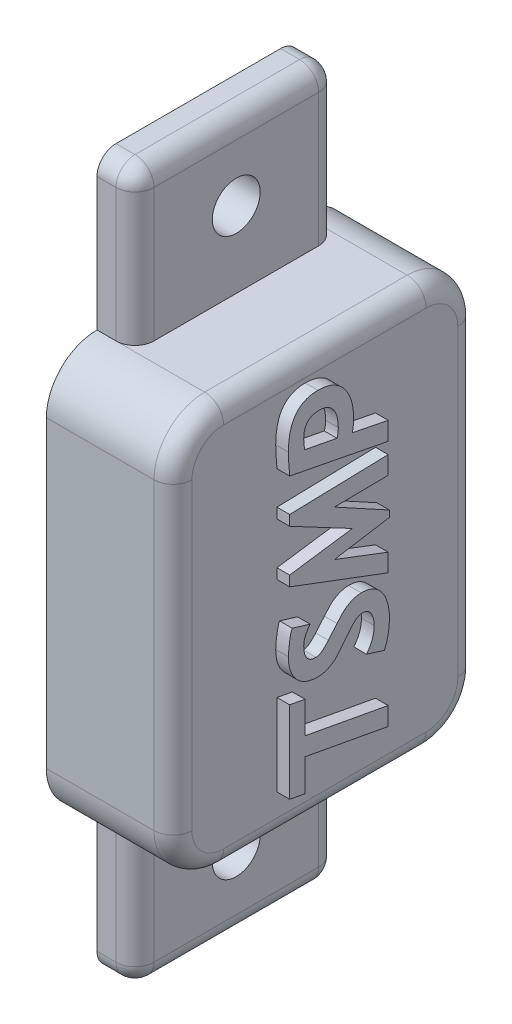
from build123d import *

# Parameters (mm, degrees)
BOSS_EXTRUDE1_DEPTH  = 6.35
SHELL1_T             = -1.27
SKETCH2_W            = 3.81
SKETCH2_H            = 20.32
BOSS_EXTRUDE2_DEPTH  = 15.24
M4_CLEARANCE_HOLE1_D = 4.8
BOSS_EXTRUDE3_DEPTH  = 1.27
FILLET1_R            = 1.905


with BuildPart() as part:
    # Sketch1 → Boss-Extrude1 (new, symmetric)
    with BuildSketch(Plane(origin=(0, 0, 0), x_dir=(0, 0, -1), z_dir=(1, 0, 0))):
        with BuildLine():
            Line((10.16, 20.32), (-10.16, 20.32))
            ThreePointArc((-10.16, 20.32), (-13.752102448, 18.832102448), (-15.24, 15.24))
            Line((-15.24, 15.24), (-15.24, -15.24))
            ThreePointArc((-15.24, -15.24), (-13.752102448, -18.832102448), (-10.16, -20.32))
            Line((-10.16, -20.32), (10.16, -20.32))
            ThreePointArc((10.16, -20.32), (13.752102448, -18.832102448), (15.24, -15.24))
            Line((15.24, -15.24), (15.24, 15.24))
            ThreePointArc((15.24, 15.24), (13.752102448, 18.832102448), (10.16, 20.32))
        make_face()
    extrude(amount=BOSS_EXTRUDE1_DEPTH, both=True)

    # Shell1
    shell1_openings = [part.faces().sort_by_distance(p)[0] for p in [
        (-6.35, 0, 0),
    ]]
    offset(amount=SHELL1_T, openings=shell1_openings, kind=Kind.INTERSECTION)

    # Sketch2 → Boss-Extrude2 (add)
    with BuildSketch(Plane.XZ.offset(20.32)):
        with Locations((-4.445, 0)):
            Rectangle(SKETCH2_W, SKETCH2_H)
    boss_extrude2 = extrude(amount=BOSS_EXTRUDE2_DEPTH)

    # M4 Clearance Hole1 (through all)
    with Locations(Plane(origin=(-2.54, 0, 0), x_dir=(0, 0, -1), z_dir=(1, 0, 0))):
        with Locations((0, -27.94)):
            m4_clearance_hole1 = Hole(M4_CLEARANCE_HOLE1_D / 2)

    # Mirror1: Boss-Extrude2, M4 Clearance Hole1 across plane
    add(boss_extrude2.mirror(Plane.ZX))
    add(m4_clearance_hole1.mirror(Plane.ZX), mode=Mode.SUBTRACT)

    # Sketch8 → Boss-Extrude3 (add)
    # profile 1 of 4: a face of its own
    with BuildSketch(Plane(origin=(6.35, 0, 0), x_dir=(0, 0, -1), z_dir=(1, 0, 0))):
        Polygon((-3.263618594, -8.225283619), (-3.263618594, -11.400271175), (5.08, -12.938625853), (5.08, -14.761786743), (-3.263618594, -13.221426387), (-3.263618594, -16.430510462), (-4.80397895, -16.14570425), (-4.80397895, -7.934460374), align=None)
    # profile 2 of 4: a face of its own
    with BuildSketch(Plane(origin=(6.35, 0, 0), x_dir=(0, 0, -1), z_dir=(1, 0, 0))):
        with BuildLine():
            add(Edge.make_bspline(
                [(-2.750165142, -1.95352993), (-2.80125104, -2.017677687), (-2.900986105, -2.142913435), (-3.031358515, -2.338261172), (-3.143006892, -2.533506612), (-3.233848259, -2.730752845), (-3.303890362, -2.928950045), (-3.354883675, -3.127492488), (-3.386187219, -3.327085952), (-3.39005041, -3.461020967), (-3.391981957, -3.527986804)],
                knots=[0, 0, 0, 0, 1.133835457, 2.213588423, 3.244729749, 4.241933598, 5.212939244, 6.148192762, 7.07411947, 8, 8, 8, 8], degree=3))
            add(Edge.make_bspline(
                [(-3.391981957, -3.527986804), (-3.3916293, -3.592878461), (-3.390944594, -3.718869665), (-3.373803164, -3.900934818), (-3.349810891, -4.070269357), (-3.319309536, -4.227879526), (-3.274070717, -4.37216332), (-3.222660858, -4.505639649), (-3.160855456, -4.626504675), (-3.087780872, -4.734006273), (-3.005813293, -4.828538209), (-2.913292027, -4.910514792), (-2.811858608, -4.980505864), (-2.699620978, -5.036969834), (-2.579328244, -5.08160209), (-2.448326395, -5.110523489), (-2.308949539, -5.131974126), (-2.212064918, -5.133667989), (-2.162501621, -5.134534519)],
                knots=[0, 0, 0, 0, 1.348400188, 2.618003204, 3.79729431, 4.903916575, 5.950249029, 6.936131378, 7.874740588, 8.765194314, 9.632015617, 10.468790778, 11.328451844, 12.186200925, 13.074374078, 13.987954761, 14.97069735, 16, 16, 16, 16], degree=3))
            add(Edge.make_bspline(
                [(-2.162501621, -5.134534519), (-2.117436706, -5.131528884), (-2.024312956, -5.125317932), (-1.88280649, -5.081657896), (-1.736607088, -5.012195006), (-1.58315581, -4.916720556), (-1.425322977, -4.792915034), (-1.260334105, -4.64296288), (-1.088306144, -4.467290665), (-0.976998716, -4.336338494), (-0.918981542, -4.268081819)],
                knots=[0, 0, 0, 0, 0.694159026, 1.434435008, 2.264250846, 3.185048469, 4.213538291, 5.351707008, 6.619620628, 8, 8, 8, 8], degree=3))
            Line((-0.918981542, -4.268081819), (-0.054534519, -3.24518627))
            add(Edge.make_bspline(
                [(-0.054534519, -3.24518627), (0.007627221, -3.172308071), (0.122069723, -3.038136097), (0.279085299, -2.854357732), (0.413087131, -2.710696977), (0.521828813, -2.591380531), (0.63069573, -2.492559642), (0.748004134, -2.396766845), (0.884686606, -2.300051516), (1.086844297, -2.168430987), (1.353379879, -2.021290492), (1.687687303, -1.892462062), (2.026955675, -1.812767653), (2.256261402, -1.80229614), (2.370329635, -1.797087082)],
                knots=[0, 0, 0, 0, 1.177344829, 2.16754369, 2.970114562, 3.592054745, 4.150321937, 4.775294408, 5.452530373, 6.206922649, 7.740144076, 9.18372903, 10.599044785, 12, 12, 12, 12], degree=3))
            add(Edge.make_bspline(
                [(2.370329635, -1.797087082), (2.478836795, -1.799964201), (2.69094982, -1.805588481), (2.998846952, -1.855418306), (3.28972316, -1.932701452), (3.560883137, -2.045837123), (3.814753113, -2.189996227), (4.050631053, -2.364961838), (4.266669818, -2.574066327), (4.461480384, -2.813118763), (4.638288906, -3.075229865), (4.789881922, -3.359679973), (4.921682336, -3.660747475), (5.025154706, -3.982411783), (5.10687616, -4.321730324), (5.16790922, -4.680057446), (5.201067337, -5.057685433), (5.205896626, -5.315653535), (5.208363363, -5.447420217)],
                knots=[0, 0, 0, 0, 1.000944879, 1.956676835, 2.8713823, 3.773321029, 4.66046572, 5.560227304, 6.476762848, 7.428101528, 8.401990658, 9.390473608, 10.399320134, 11.431674743, 12.504852098, 13.618809142, 14.783719319, 16, 16, 16, 16], degree=3))
            add(Edge.make_bspline(
                [(5.208363363, -5.447420217), (5.206855206, -5.557777808), (5.203862691, -5.776751431), (5.178842454, -6.102740636), (5.139239727, -6.423452807), (5.082416071, -6.739992962), (5.010856006, -7.052140548), (4.921802425, -7.359874574), (4.818672032, -7.663007591), (4.736163682, -7.860022177), (4.694909911, -7.958528505)],
                knots=[0, 0, 0, 0, 1.02600741, 2.035823327, 3.038187761, 4.02956232, 5.024807818, 6.014465778, 7.00724262, 8, 8, 8, 8], degree=3))
            Line((4.694909911, -7.958528505), (2.897822829, -7.388916082))
            add(Edge.make_bspline(
                [(2.897822829, -7.388916082), (2.959364284, -7.312381552), (3.080897423, -7.161239828), (3.237818498, -6.91868989), (3.370486213, -6.66757251), (3.479726078, -6.407287772), (3.564256024, -6.137321737), (3.623924089, -5.858006554), (3.661279945, -5.570110201), (3.665746681, -5.37532925), (3.668003007, -5.276937625)],
                knots=[0, 0, 0, 0, 1.025794438, 2.02575676, 3.013365359, 3.990439165, 4.971576287, 5.965098467, 6.972090103, 8, 8, 8, 8], degree=3))
            add(Edge.make_bspline(
                [(3.668003007, -5.276937625), (3.663994722, -5.161083602), (3.656274846, -4.937951143), (3.601877118, -4.617508863), (3.501824564, -4.329519036), (3.389585851, -4.113482056), (3.282231782, -3.960506275), (3.191956208, -3.862792545), (3.095092781, -3.778818092), (2.988821213, -3.711558275), (2.874408538, -3.660154277), (2.752264675, -3.620636889), (2.621787845, -3.59925378), (2.532190601, -3.59588574), (2.486658932, -3.594174164)],
                knots=[0, 0, 0, 0, 1.812571679, 3.490975677, 5.062215305, 6.564139531, 7.283970624, 7.979844383, 8.640140766, 9.284334025, 9.939640691, 10.597945725, 11.287501843, 12, 12, 12, 12], degree=3))
            add(Edge.make_bspline(
                [(2.486658932, -3.594174164), (2.438951786, -3.597212088), (2.340631421, -3.603472991), (2.1925958, -3.645712179), (2.043176312, -3.716144538), (1.889639511, -3.811584745), (1.733068719, -3.935429567), (1.57348056, -4.087000052), (1.408564625, -4.263212942), (1.303746122, -4.394340407), (1.249155886, -4.462632541)],
                knots=[0, 0, 0, 0, 0.734068962, 1.51285361, 2.350769121, 3.270192263, 4.289022369, 5.417311782, 6.654917253, 8, 8, 8, 8], degree=3))
            Line((1.249155886, -4.462632541), (0.404765639, -5.527647318))
            add(Edge.make_bspline(
                [(0.404765639, -5.527647318), (0.344161042, -5.602718848), (0.233172899, -5.740200986), (0.078190288, -5.925533002), (-0.0489091, -6.072532992), (-0.157785231, -6.186597947), (-0.260952852, -6.281911519), (-0.375599357, -6.370811159), (-0.507280539, -6.461763927), (-0.702176664, -6.586646654), (-0.963589433, -6.722379395), (-1.291549182, -6.844902551), (-1.631844494, -6.917501274), (-1.861979507, -6.926889471), (-1.977979286, -6.931621601)],
                knots=[0, 0, 0, 0, 1.206671615, 2.209836345, 3.021614333, 3.63664281, 4.181119786, 4.776625886, 5.44931724, 6.182341803, 7.67082524, 9.123194503, 10.549943351, 12, 12, 12, 12], degree=3))
            add(Edge.make_bspline(
                [(-1.977979286, -6.931621601), (-2.088436006, -6.929053441), (-2.304834699, -6.92402209), (-2.62050583, -6.880880309), (-2.918727289, -6.81204172), (-3.198077668, -6.711302875), (-3.462534406, -6.589054057), (-3.70587649, -6.432018726), (-3.933410594, -6.250176307), (-4.14030324, -6.039987171), (-4.326720414, -5.807190911), (-4.489787292, -5.55609666), (-4.626674869, -5.28691941), (-4.739783954, -5.001105155), (-4.825105438, -4.697029016), (-4.887008478, -4.37639866), (-4.926313289, -4.039074292), (-4.930305531, -3.808223382), (-4.932342313, -3.690446686)],
                knots=[0, 0, 0, 0, 1.071649996, 2.099497959, 3.086361209, 4.036619296, 4.977078349, 5.907748306, 6.840090789, 7.799082401, 8.76385244, 9.730388481, 10.699686961, 11.690191589, 12.708987071, 13.76016689, 14.857270507, 16, 16, 16, 16], degree=3))
            add(Edge.make_bspline(
                [(-4.932342313, -3.690446686), (-4.930462207, -3.60483434), (-4.926447217, -3.422008045), (-4.902699038, -3.131017922), (-4.866182337, -2.806698164), (-4.818831787, -2.463228834), (-4.759311523, -2.132128916), (-4.696669399, -1.841035416), (-4.629643785, -1.605349605), (-4.572432677, -1.471089287), (-4.547252224, -1.411996993)],
                knots=[0, 0, 0, 0, 0.885005776, 1.889941524, 3.016369979, 4.258554003, 5.473153608, 6.492574728, 7.336533537, 8, 8, 8, 8], degree=3))
            Line((-4.547252224, -1.411996993), (-2.750165142, -1.95352993))
        make_face()
    # profile 3 of 4: a face of its own
    with BuildSketch(Plane(origin=(6.35, 0, 0), x_dir=(0, 0, -1), z_dir=(1, 0, 0))):
        Polygon((5.08, 7.059984964), (-0.311261245, 6.995803283), (5.208363363, 3.979264252), (5.208363363, 3.337447438), (-0.311261245, 2.438903897), (5.08, 0.385090089), (5.08, -1.411996993), (-4.80397895, 2.310540534), (-4.80397895, 3.337447438), (1.485825836, 4.235990978), (-4.80397895, 7.573438416), (-4.80397895, 8.60034532), (5.08, 8.857072046), align=None)
    # profile 4 of 4: a face of its own
    with BuildSketch(Plane(origin=(6.35, 0, 0), x_dir=(0, 0, -1), z_dir=(1, 0, 0))):
        with BuildLine():
            Line((1.485825836, 12.549524409), (5.08, 11.839514558))
            Line((5.08, 11.839514558), (5.08, 10.012342313))
            Line((5.08, 10.012342313), (-4.80397895, 11.937792757))
            add(Edge.make_bspline(
                [(-4.80397895, 11.937792757), (-4.814156449, 12.051434856), (-4.833847704, 12.271307686), (-4.860016651, 12.59088044), (-4.882078557, 12.889067657), (-4.900309123, 13.166519858), (-4.914485749, 13.423257287), (-4.924511389, 13.659275476), (-4.931022551, 13.874572005), (-4.931917059, 14.010990788), (-4.932342313, 14.075845022)],
                knots=[0, 0, 0, 0, 1.278075582, 2.47279924, 3.591696274, 4.62737318, 5.587396976, 6.471891417, 7.273528833, 8, 8, 8, 8], degree=3))
            add(Edge.make_bspline(
                [(-4.932342313, 14.075845022), (-4.929994019, 14.233018019), (-4.925441487, 14.537722257), (-4.89155068, 14.979844931), (-4.834371192, 15.392089824), (-4.752611172, 15.773582457), (-4.648650738, 16.124611989), (-4.522356955, 16.446063441), (-4.372807301, 16.7381611), (-4.197662971, 16.998753815), (-3.998688334, 17.228092416), (-3.777747093, 17.428874214), (-3.529803779, 17.595220741), (-3.262179375, 17.735411413), (-2.969855722, 17.841393104), (-2.655210366, 17.917798277), (-2.316805288, 17.96114947), (-2.083733047, 17.967570542), (-1.963939544, 17.970870818)],
                knots=[0, 0, 0, 0, 1.349950348, 2.617088167, 3.806041765, 4.922249814, 5.965128403, 6.947263793, 7.884733045, 8.778256218, 9.637211465, 10.487057785, 11.33441701, 12.194849098, 13.076015182, 13.998055437, 14.971048836, 16, 16, 16, 16], degree=3))
            add(Edge.make_bspline(
                [(-1.963939544, 17.970870818), (-1.828012188, 17.967787718), (-1.562952501, 17.961775643), (-1.177130868, 17.903782877), (-0.813470233, 17.811477848), (-0.470827565, 17.684602911), (-0.15298743, 17.514847555), (0.144163358, 17.311681133), (0.418059524, 17.069558943), (0.665037351, 16.791227647), (0.890743886, 16.488034969), (1.081961827, 16.156716338), (1.248142725, 15.806492065), (1.38221737, 15.433549866), (1.486747174, 15.038929234), (1.559108714, 14.622807642), (1.607848845, 14.185307146), (1.612041718, 13.886113427), (1.614189199, 13.732874162)],
                knots=[0, 0, 0, 0, 1.043771036, 2.035363831, 2.989681643, 3.92274997, 4.834970567, 5.751116451, 6.682769793, 7.63575955, 8.605600203, 9.581732248, 10.569793031, 11.580480364, 12.622100466, 13.702246182, 14.823150069, 16, 16, 16, 16], degree=3))
            add(Edge.make_bspline(
                [(1.614189199, 13.732874162), (1.612668604, 13.633207172), (1.609633206, 13.434252989), (1.584417121, 13.137025147), (1.545360043, 12.841560925), (1.505684214, 12.646936835), (1.485825836, 12.549524409)],
                knots=[0, 0, 0, 0, 1.002792616, 2.001763936, 2.999851341, 4, 4, 4, 4], degree=3))
        make_face()
        with BuildLine():
            Line((-3.285681047, 13.468124725), (-0.054534519, 12.844359008))
            add(Edge.make_bspline(
                [(-0.054534519, 12.844359008), (-0.034389061, 12.904147934), (0.008182138, 13.030493348), (0.045042439, 13.236945911), (0.070066075, 13.466159412), (0.072531969, 13.626489962), (0.073828844, 13.710811709)],
                knots=[0, 0, 0, 0, 0.859054739, 1.815346687, 2.851037535, 4, 4, 4, 4], degree=3))
            add(Edge.make_bspline(
                [(0.073828844, 13.710811709), (0.072049248, 13.802425308), (0.068562733, 13.981911076), (0.048426275, 14.243680523), (0.005595908, 14.490136473), (-0.043212252, 14.723412765), (-0.115963113, 14.941015423), (-0.19773167, 15.145815837), (-0.300310289, 15.334389308), (-0.415350356, 15.508461826), (-0.545197842, 15.665180046), (-0.689167391, 15.801471519), (-0.84690039, 15.916631203), (-1.017866417, 16.011429658), (-1.202840813, 16.08402228), (-1.40074977, 16.135698609), (-1.61249225, 16.169005793), (-1.758562062, 16.172162654), (-1.833570503, 16.173783736)],
                knots=[0, 0, 0, 0, 1.24919241, 2.447368744, 3.574156844, 4.657648451, 5.69239348, 6.697780648, 7.660149803, 8.613150923, 9.538556275, 10.428310763, 11.30882092, 12.194082615, 13.086028448, 14.010131266, 14.978180703, 16, 16, 16, 16], degree=3))
            add(Edge.make_bspline(
                [(-1.833570503, 16.173783736), (-1.896464905, 16.17283222), (-2.018587962, 16.170984647), (-2.195892267, 16.150898559), (-2.360690984, 16.116296397), (-2.515046517, 16.071710293), (-2.654406343, 16.008300871), (-2.784401337, 15.936080569), (-2.899772308, 15.846944023), (-3.006023366, 15.74695384), (-3.09542669, 15.630213154), (-3.178054972, 15.50368517), (-3.242153196, 15.360749146), (-3.297140382, 15.205827013), (-3.341340613, 15.038285162), (-3.370454454, 14.856219611), (-3.388863548, 14.661216875), (-3.39091994, 14.526498561), (-3.391981957, 14.456923756)],
                knots=[0, 0, 0, 0, 1.135201323, 2.204238386, 3.215063188, 4.173506686, 5.097587238, 5.973423975, 6.852167028, 7.722915285, 8.599500281, 9.500267513, 10.445316252, 11.418842399, 12.466959104, 13.568285608, 14.744149559, 16, 16, 16, 16], degree=3))
            add(Edge.make_bspline(
                [(-3.391981957, 14.456923756), (-3.390904793, 14.37933002), (-3.388700582, 14.220549198), (-3.367406535, 13.977538618), (-3.333416827, 13.72529466), (-3.301791366, 13.554916848), (-3.285681047, 13.468124725)],
                knots=[0, 0, 0, 0, 0.934643629, 1.91257042, 2.936642971, 4, 4, 4, 4], degree=3))
        make_face(mode=Mode.SUBTRACT)
    extrude(amount=BOSS_EXTRUDE3_DEPTH)

    # Fillet1
    fillet1_edges = [part.edges().sort_by_distance(p)[0] for p in [
        (6.35, 18.832102448, -13.752102448),
        (6.35, 20.32, 0),
        (6.35, 18.832102448, 13.752102448),
        (6.35, 0, 15.24),
        (6.35, -18.832102448, 13.752102448),
        (6.35, -20.32, 0),
        (-2.54, -27.94, -10.16),
        (-2.54, -27.94, 10.16),
        (-4.445, -35.56, -10.16),
        (-2.54, -35.56, 0),
        (-4.445, -35.56, 10.16),
        (6.35, -18.832102448, -13.752102448),
        (-4.445, 35.56, 10.16),
        (-2.54, 35.56, 0),
        (-2.54, 27.94, 10.16),
        (-4.445, 35.56, -10.16),
        (-2.54, 27.94, -10.16),
        (6.35, 0, -15.24),
    ]]
    fillet(fillet1_edges, radius=FILLET1_R)


solid = part.part
